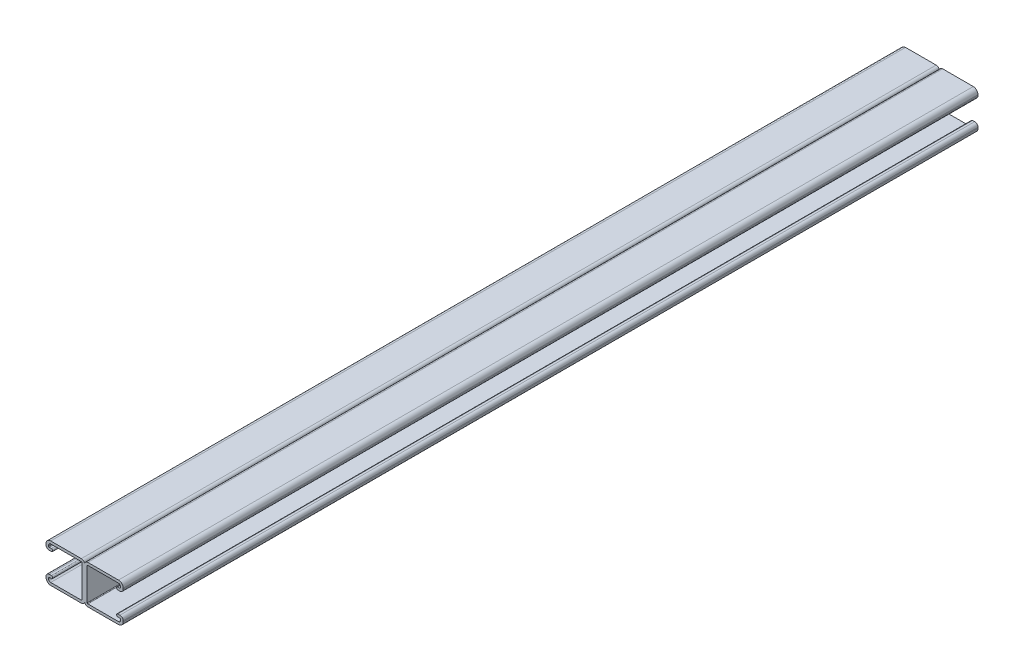
from build123d import *

# Parameters (mm, degrees)
BOSS_EXTRUDE1_DEPTH = 914.4


with BuildPart() as part:
    # Sketch1 → Boss-Extrude1 (new body)
    with BuildSketch(Plane.XY):
        with BuildLine():
            Line((-36.22675, 20.6375), (-3.46075, 20.6375))
            ThreePointArc((-3.46075, 20.6375), (-1.013630207, 19.623869793), (0, 17.17675))
            Line((0, 17.17675), (0, -17.17675))
            ThreePointArc((0, -17.17675), (-1.013630207, -19.623869793), (-3.46075, -20.6375))
            Line((-3.46075, -20.6375), (-36.22675, -20.6375))
            ThreePointArc((-36.22675, -20.6375), (-39.796401808, -19.158901808), (-41.275, -15.58925))
            Line((-41.275, -15.58925), (-41.275, -14.57325))
            ThreePointArc((-41.275, -14.57325), (-40.261369793, -12.126130207), (-37.81425, -11.1125))
            Line((-37.81425, -11.1125), (-35.5346, -11.1125))
            ThreePointArc((-35.5346, -11.1125), (-34.1376, -12.5095), (-35.5346, -13.9065))
            Line((-35.5346, -13.9065), (-37.81425, -13.9065))
            ThreePointArc((-37.81425, -13.9065), (-38.285713446, -14.101786554), (-38.481, -14.57325))
            Line((-38.481, -14.57325), (-38.481, -15.58925))
            ThreePointArc((-38.481, -15.58925), (-37.820745461, -17.183245461), (-36.22675, -17.8435))
            Line((-36.22675, -17.8435), (-3.46075, -17.8435))
            ThreePointArc((-3.46075, -17.8435), (-2.989286554, -17.648213446), (-2.794, -17.17675))
            Line((-2.794, -17.17675), (-2.794, 17.17675))
            ThreePointArc((-2.794, 17.17675), (-2.989286554, 17.648213446), (-3.46075, 17.8435))
            Line((-3.46075, 17.8435), (-36.22675, 17.8435))
            ThreePointArc((-36.22675, 17.8435), (-37.820745461, 17.183245461), (-38.481, 15.58925))
            Line((-38.481, 15.58925), (-38.481, 14.57325))
            ThreePointArc((-38.481, 14.57325), (-38.285713446, 14.101786554), (-37.81425, 13.9065))
            Line((-37.81425, 13.9065), (-35.5346, 13.9065))
            ThreePointArc((-35.5346, 13.9065), (-34.1376, 12.5095), (-35.5346, 11.1125))
            Line((-35.5346, 11.1125), (-37.81425, 11.1125))
            ThreePointArc((-37.81425, 11.1125), (-40.261369793, 12.126130207), (-41.275, 14.57325))
            Line((-41.275, 14.57325), (-41.275, 15.58925))
            ThreePointArc((-41.275, 15.58925), (-39.796401808, 19.158901808), (-36.22675, 20.6375))
        make_face()
    extrude(amount=-BOSS_EXTRUDE1_DEPTH)


with BuildPart() as body_2:
    # Mirror1: mirrored copy
    add(part.part.mirror(Plane(origin=(0, 17.17675, -914.4), x_dir=(0, 0, 1), z_dir=(1, 0, 0))))


with BuildPart() as part_1:
    add(part.part)

    # Combine1: union body 2
    add(body_2.part)


solid = part_1.part
